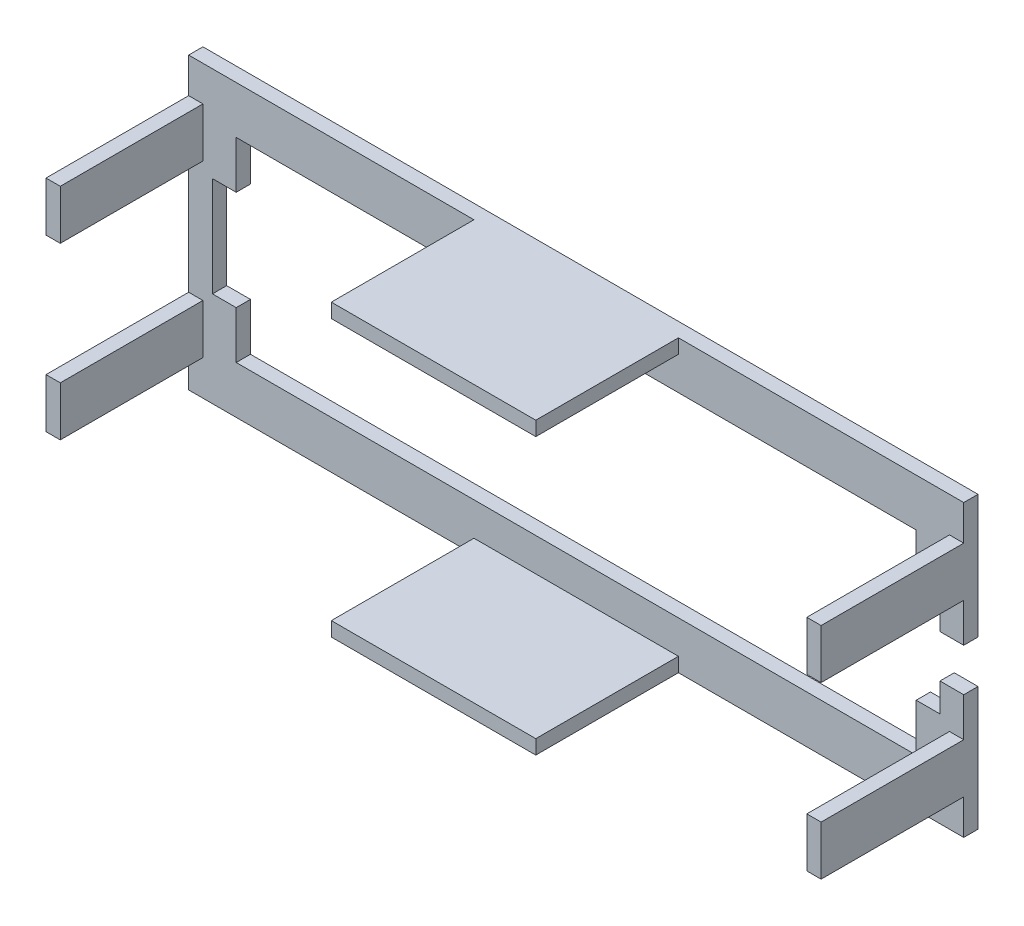
from build123d import *

# Parameters (mm, degrees)
BOSS_EXTRUDE1_DEPTH = 1.5
SKETCH2_W           = 1.5
SKETCH2_H           = 5.2
SKETCH2_W_2         = 21.5
SKETCH2_H_2         = 1.5
BOSS_EXTRUDE2_DEPTH = 15


with BuildPart() as part:
    # Sketch1 → Boss-Extrude1 (new body)
    with BuildSketch(Plane.XY):
        Polygon((0, 0), (81.5, 0), (81.5, 13), (79, 13), (79, 10), (76.5, 10), (76.5, 5), (5, 5), (5, 10), (2.5, 10), (2.5, 20.5), (5, 20.5), (5, 25.5), (76.5, 25.5), (76.5, 20.5), (79, 20.5), (79, 17.5), (81.5, 17.5), (81.5, 30.5), (0, 30.5), align=None)
    extrude(amount=BOSS_EXTRUDE1_DEPTH)

    # Sketch2 → Boss-Extrude2 (add)
    with BuildSketch(Plane.XY.offset(1.5)):
        with Locations((0.75, 24.2)):
            Rectangle(SKETCH2_W, SKETCH2_H)
        with Locations((40.75, 0.75)):
            Rectangle(SKETCH2_W_2, SKETCH2_H_2)
        with Locations((80.75, 6.3)):
            Rectangle(SKETCH2_W, SKETCH2_H)
        with Locations((40.75, 29.75)):
            Rectangle(SKETCH2_W_2, SKETCH2_H_2)
        with Locations((80.75, 24.2)):
            Rectangle(SKETCH2_W, SKETCH2_H)
        with Locations((0.75, 6.3)):
            Rectangle(SKETCH2_W, SKETCH2_H)
    extrude(amount=BOSS_EXTRUDE2_DEPTH)


solid = part.part
